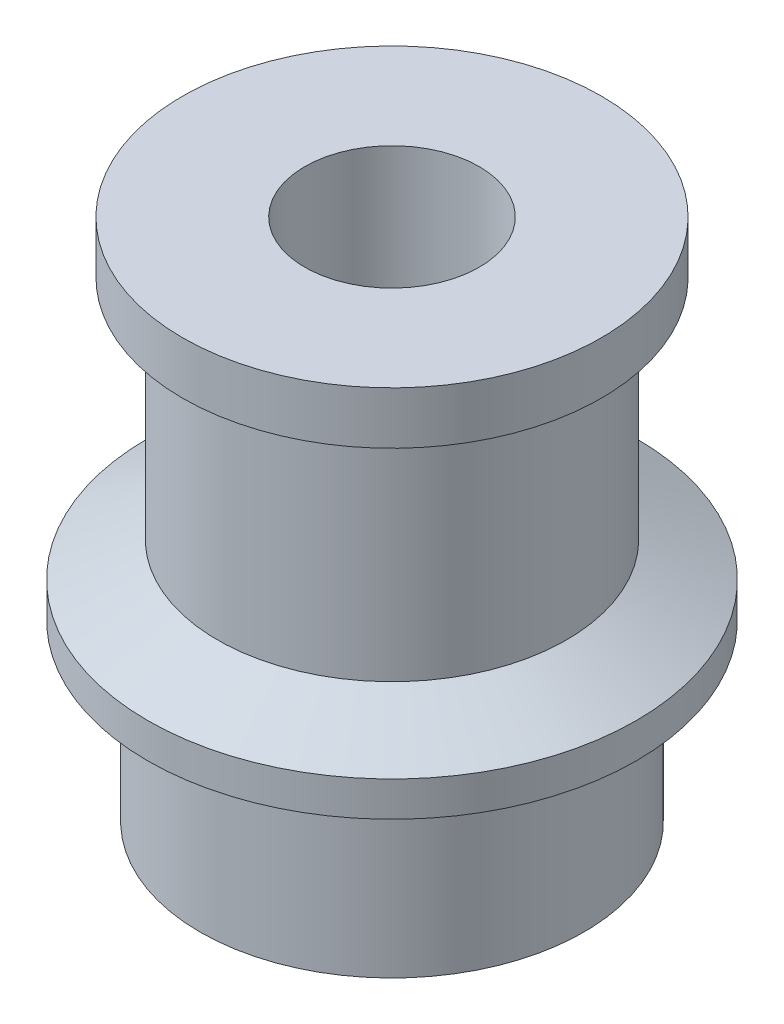
from build123d import *


with BuildPart() as part:
    # Sketch2 → Revolve1 (revolve)
    with BuildSketch(Plane.XY, mode=Mode.PRIVATE) as revolve1_sk:
        Polygon((0, 14), (-5, 14), (-5, 30), (-12, 30), (-12, 27), (-10, 27), (-10, 14), (-14, 12), (-14, 10), (-11, 10), (-11, 0), (0, 0), align=None)
    revolve(revolve1_sk.sketch.rotate(Axis((0, 0, 0), (0, 1, 0)), 270), axis=Axis((0, 0, 0), (0, 1, 0)))


solid = part.part
